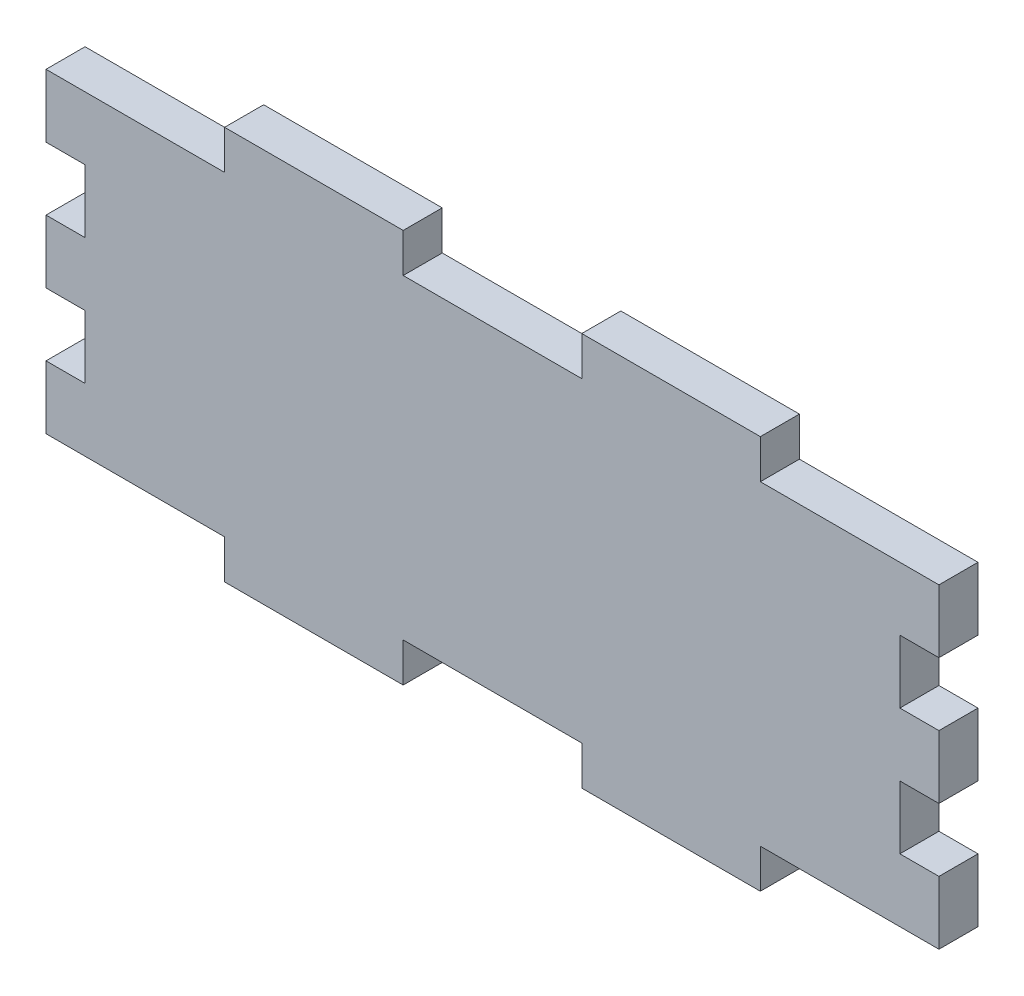
from build123d import *

# Parameters (mm, degrees)
SKETCH3_R           = 4
BOSS_EXTRUDE2_DEPTH = 10


with BuildPart() as part:
    # Sketch3 → Boss-Extrude2 (new body)
    # profile 1 of 5: a face of its own
    with BuildSketch(Plane.XY):
        Polygon((102.429124183, -12.51217232), (56.709124183, -12.51217232), (56.709124183, -22.51217232), (10.989124183, -22.51217232), (10.989124183, -12.51217232), (-24.730875817, -12.51217232), (-34.730875817, -12.51217232), (-34.730875817, 3.64782768), (-24.730875817, 3.64782768), (-24.730875817, 19.80782768), (-34.730875817, 19.80782768), (-34.730875817, 35.96782768), (-24.730875817, 35.96782768), (-24.730875817, 52.12782768), (-34.730875817, 52.12782768), (-34.730875817, 68.28782768), (-24.730875817, 68.28782768), (10.989124183, 68.28782768), (10.989124183, 78.28782768), (56.709124183, 78.28782768), (56.709124183, 68.28782768), (102.429124183, 68.28782768), (102.429124183, 78.28782768), (148.149124183, 78.28782768), (148.149124183, 68.28782768), (183.869124183, 68.28782768), (193.869124183, 68.28782768), (193.869124183, 52.12782768), (183.869124183, 52.12782768), (183.869124183, 35.96782768), (193.869124183, 35.96782768), (193.869124183, 19.80782768), (183.869124183, 19.80782768), (183.869124183, 3.64782768), (193.869124183, 3.64782768), (193.869124183, -12.51217232), (183.869124183, -12.51217232), (148.149124183, -12.51217232), (148.149124183, -22.51217232), (102.429124183, -22.51217232), align=None)
        with Locations((-12.030875817, 55.58782768)):
            Circle(SKETCH3_R, mode=Mode.SUBTRACT)
        with Locations((171.169124183, 55.58782768)):
            Circle(SKETCH3_R, mode=Mode.SUBTRACT)
        with Locations((-12.030875817, 0.18782768)):
            Circle(SKETCH3_R, mode=Mode.SUBTRACT)
        with Locations((171.169124183, 0.18782768)):
            Circle(SKETCH3_R, mode=Mode.SUBTRACT)
    # profile 2 of 5: a face of its own
    with BuildSketch(Plane.XY):
        with Locations((-12.030875817, 55.58782768)):
            Circle(SKETCH3_R)
    # profile 3 of 5: a face of its own
    with BuildSketch(Plane.XY):
        with Locations((-12.030875817, 0.18782768)):
            Circle(SKETCH3_R)
    # profile 4 of 5: a face of its own
    with BuildSketch(Plane.XY):
        with Locations((171.169124183, 0.18782768)):
            Circle(SKETCH3_R)
    # profile 5 of 5: a face of its own
    with BuildSketch(Plane.XY):
        with Locations((171.169124183, 55.58782768)):
            Circle(SKETCH3_R)
    extrude(amount=BOSS_EXTRUDE2_DEPTH)


solid = part.part
